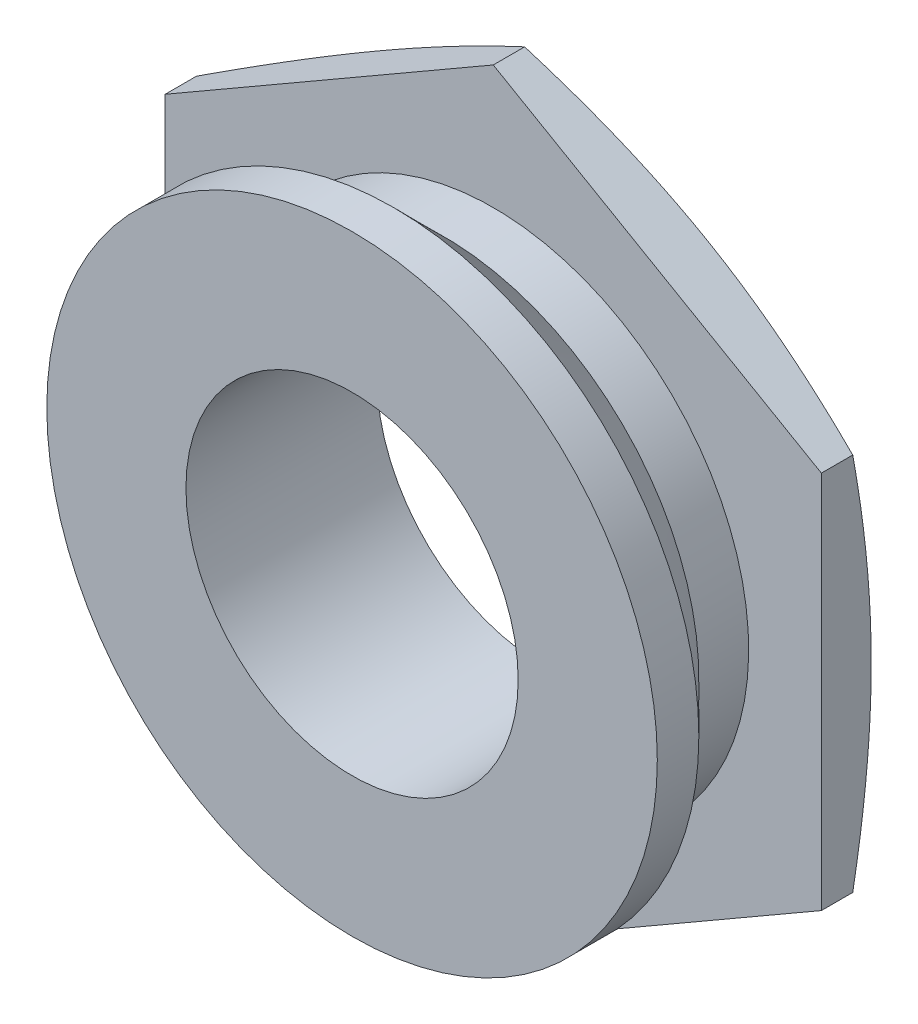
from build123d import *

# Parameters (mm, degrees)
BOSS_EXTRUDE1_DEPTH = 0.6
SKETCH6_W           = 2.3
SKETCH6_H           = 2


with BuildPart() as part:
    # Sketch1 → Revolve1 (revolve)
    with BuildSketch(Plane.ZY, mode=Mode.PRIVATE) as revolve1_sk:
        Polygon((0, 3.075), (0.6, 3.075), (1.2, 3.675), (1.7, 3.675), (1.7, 0), (0, 0), (-0.6, 0), (-0.6, 3.95), (0, 3.95), align=None)
    revolve(revolve1_sk.sketch.rotate(Axis((0, 0, 1.7), (0, 0, -1)), 180), axis=Axis((0, 0, 1.7), (0, 0, -1)))

    # Sketch3 → Boss-Extrude1 (add)
    with BuildSketch(Plane(origin=(0, 0, -0.6), x_dir=(-1, 0, 0), z_dir=(0, 0, -1))):
        Polygon((0, 4.561067127), (-3.95, 2.280533563), (-3.95, -2.280533563), (0, -4.561067127), (3.95, -2.280533563), (3.95, 2.280533563), align=None)
    extrude(amount=-BOSS_EXTRUDE1_DEPTH)

    # Sketch10 → Cut-Revolve4 (revolve, cut)
    with BuildSketch(Plane(origin=(0, 0, 0), x_dir=(0, 0, -1), z_dir=(1, 0, 0))):
        Polygon((0.377589755, 4.561067127), (0.6, 4.561067127), (0.6, 3.95), align=None)
    revolve(axis=Axis((0, 0, -0.6), (0, 0, 1)), mode=Mode.SUBTRACT)

    # Sketch6 → Cut-Revolve2 (revolve, cut)
    with BuildSketch(Plane(origin=(0, 0, 0), x_dir=(0, 0, -1), z_dir=(1, 0, 0)), mode=Mode.PRIVATE) as cut_revolve2_sk:
        with Locations((-0.55, 1)):
            Rectangle(SKETCH6_W, SKETCH6_H)
    revolve(cut_revolve2_sk.sketch.rotate(Axis((0, 0, -0.6), (0, 0, 1)), 90), axis=Axis((0, 0, -0.6), (0, 0, 1)), mode=Mode.SUBTRACT)


solid = part.part
